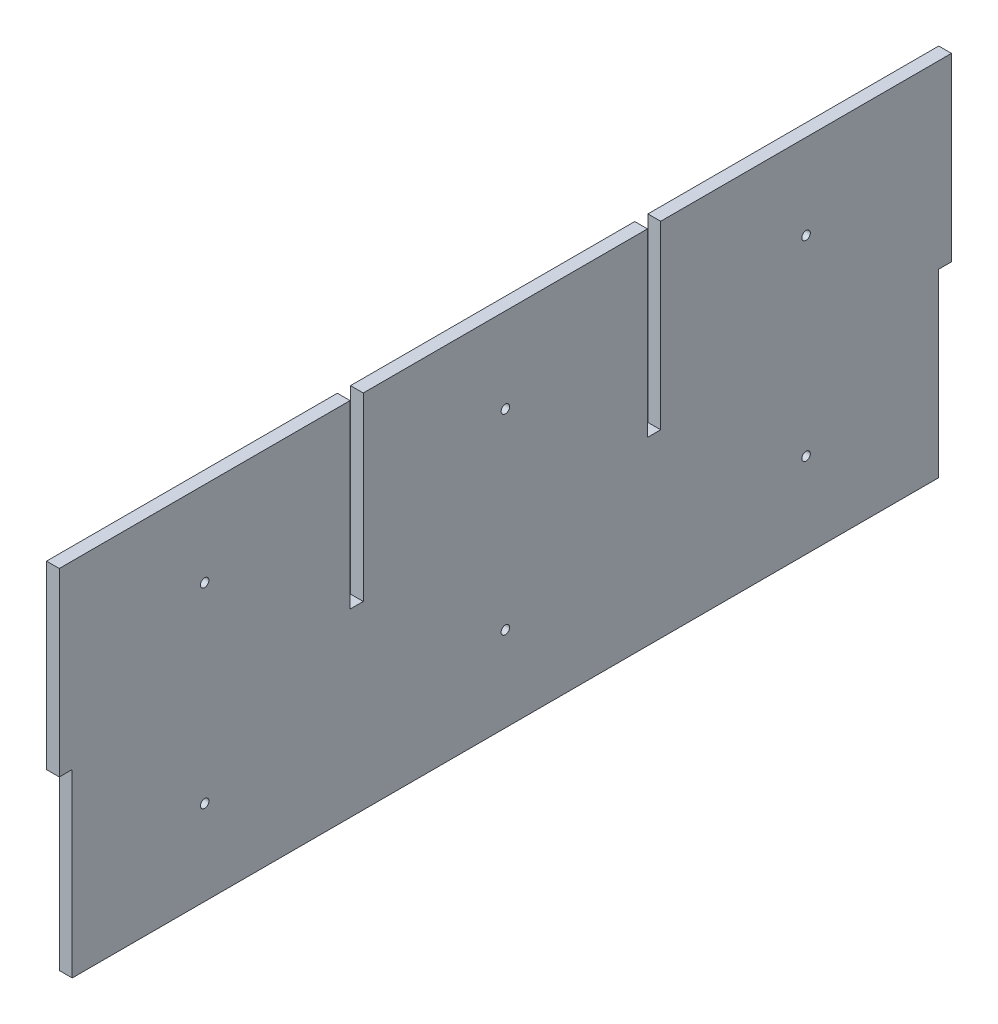
from build123d import *

# Parameters (mm, degrees)
SKETCH3_W           = 420
SKETCH3_H           = 170
BOSS_EXTRUDE2_DEPTH = 6
SKETCH4_W           = 6.1
SKETCH4_H           = 85
SKETCH4_W_2         = 6.2
CUT_EXTRUDE1_DEPTH  = 6
SKETCH5_R           = 2
CUT_EXTRUDE2_DEPTH  = 6


with BuildPart() as part:
    # Sketch3 → Boss-Extrude2 (new body)
    with BuildSketch(Plane(origin=(0, 0, 0), x_dir=(0, 0, -1), z_dir=(1, 0, 0))):
        with Locations((440.911700258, 161.915861829)):
            Rectangle(SKETCH3_W, SKETCH3_H)
    extrude(amount=BOSS_EXTRUDE2_DEPTH)

    # Sketch4 → Cut-Extrude1 (cut)
    with BuildSketch(Plane(origin=(6, 0, 0), x_dir=(0, 0, -1), z_dir=(1, 0, 0))):
        with Locations((233.961700258, 119.415861829)):
            Rectangle(SKETCH4_W, SKETCH4_H)
        with Locations((647.861700258, 119.415861829)):
            Rectangle(SKETCH4_W, SKETCH4_H)
        with Locations((370.911700258, 204.415861829)):
            Rectangle(SKETCH4_W_2, SKETCH4_H)
        with Locations((510.911700258, 204.415861829)):
            Rectangle(SKETCH4_W_2, SKETCH4_H)
    extrude(amount=-CUT_EXTRUDE1_DEPTH, mode=Mode.SUBTRACT)

    # Sketch5 → Cut-Extrude2 (cut)
    with BuildSketch(Plane(origin=(6, 0, 0), x_dir=(0, 0, -1), z_dir=(1, 0, 0))):
        with Locations((299.361700258, 206.915861829)):
            Circle(SKETCH5_R)
        with Locations((299.361700258, 116.915861829)):
            Circle(SKETCH5_R)
        with Locations((440.911700258, 206.915861829)):
            Circle(SKETCH5_R)
        with Locations((582.461700258, 206.915861829)):
            Circle(SKETCH5_R)
        with Locations((582.461700258, 116.915861829)):
            Circle(SKETCH5_R)
        with Locations((440.911700258, 116.915861829)):
            Circle(SKETCH5_R)
    extrude(amount=-CUT_EXTRUDE2_DEPTH, mode=Mode.SUBTRACT)


solid = part.part
